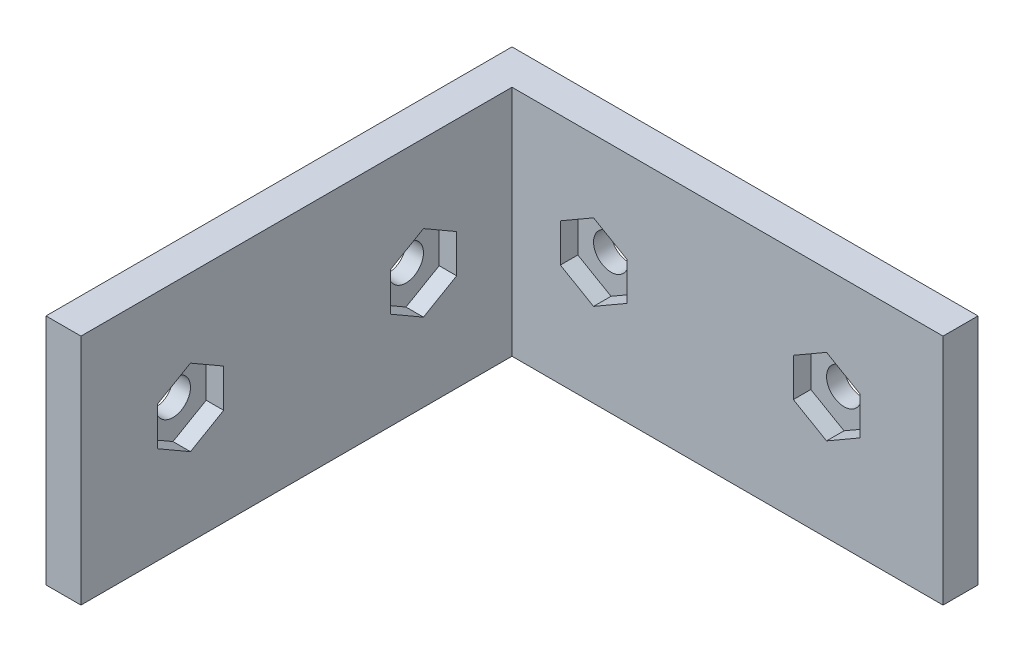
from build123d import *

# Parameters (mm, degrees)
ESQUISSE1_W             = 40
ESQUISSE1_H             = 20
BOSS_EXTRU_1_DEPTH      = 3
ESQUISSE2_R             = 1.5
ENL_V_MAT_EXTRU_1_DEPTH = 3
ESQUISSE3_W             = 3
ESQUISSE3_H             = 20
BOSS_EXTRU_2_DEPTH      = 37
ESQUISSE4_R             = 1.5
ENL_V_MAT_EXTRU_2_DEPTH = 3
ENL_V_MAT_EXTRU_3_DEPTH = 1.5
ENL_V_MAT_EXTRU_4_DEPTH = 1.5


with BuildPart() as part:
    # Esquisse1 → Boss.-Extru.1 (new body)
    with BuildSketch(Plane.XY):
        with Locations((20, 10)):
            Rectangle(ESQUISSE1_W, ESQUISSE1_H)
    extrude(amount=BOSS_EXTRU_1_DEPTH)

    # Esquisse2 → Enlèv. mat.-Extru.1 (cut)
    with BuildSketch(Plane.XY.offset(3)):
        with Locations((10, 10.5)):
            Circle(ESQUISSE2_R)
        with Locations((30, 10.5)):
            Circle(ESQUISSE2_R)
    extrude(amount=-ENL_V_MAT_EXTRU_1_DEPTH, mode=Mode.SUBTRACT)

    # Esquisse3 → Boss.-Extru.2 (add)
    with BuildSketch(Plane.XY.offset(3)):
        with Locations((1.5, 10)):
            Rectangle(ESQUISSE3_W, ESQUISSE3_H)
    extrude(amount=BOSS_EXTRU_2_DEPTH)

    # Esquisse4 → Enlèv. mat.-Extru.2 (cut)
    with BuildSketch(Plane.ZY):
        with Locations((10.6, 10)):
            Circle(ESQUISSE4_R)
        with Locations((30.6, 10)):
            Circle(ESQUISSE4_R)
    extrude(amount=-ENL_V_MAT_EXTRU_2_DEPTH, mode=Mode.SUBTRACT)

    # Esquisse5 → Enlèv. mat.-Extru.3 (cut)
    with BuildSketch(Plane(origin=(3, 0, 0), x_dir=(0, 0, -1), z_dir=(1, 0, 0))):
        Polygon((-13.45, 8.354551733), (-10.6, 6.709103466), (-7.75, 8.354551733), (-7.75, 11.645448267), (-10.6, 13.290896534), (-13.45, 11.645448267), align=None)
        Polygon((-30.6, 6.709103466), (-27.75, 8.354551733), (-27.75, 11.645448267), (-30.6, 13.290896534), (-33.45, 11.645448267), (-33.45, 8.354551733), align=None)
    extrude(amount=-ENL_V_MAT_EXTRU_3_DEPTH, mode=Mode.SUBTRACT)

    # Esquisse6 → Enlèv. mat.-Extru.4 (cut)
    with BuildSketch(Plane.XY.offset(3)):
        Polygon((27.15, 8.854551733), (30, 7.209103466), (32.85, 8.854551733), (32.85, 12.145448267), (30, 13.790896534), (27.15, 12.145448267), align=None)
        Polygon((10, 7.209103466), (12.85, 8.854551733), (12.85, 12.145448267), (10, 13.790896534), (7.15, 12.145448267), (7.15, 8.854551733), align=None)
    extrude(amount=-ENL_V_MAT_EXTRU_4_DEPTH, mode=Mode.SUBTRACT)


solid = part.part
